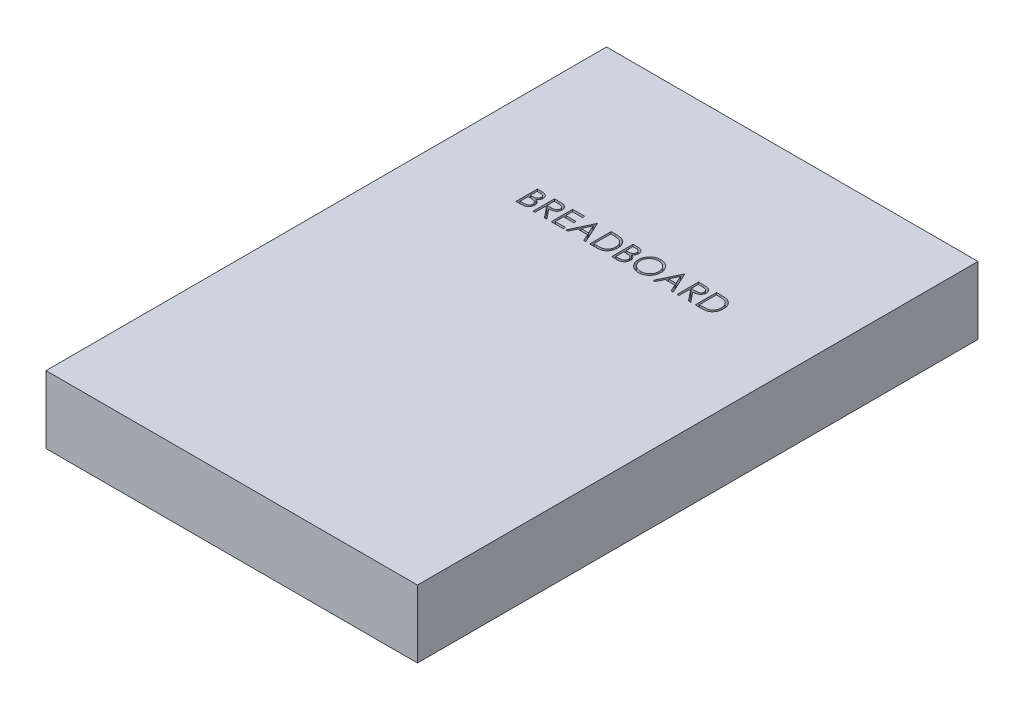
from build123d import *

# Parameters (mm, degrees)
SKETCH1_W           = 55
SKETCH1_H           = 83
BOSS_EXTRUDE1_DEPTH = 10
CUT_EXTRUDE1_DEPTH  = 1


with BuildPart() as part:
    # Sketch1 → Boss-Extrude1 (new body)
    with BuildSketch(Plane(origin=(0, 0, 0), x_dir=(1, 0, 0), z_dir=(0, 1, 0))):
        Rectangle(SKETCH1_W, SKETCH1_H)
    extrude(amount=BOSS_EXTRUDE1_DEPTH)

    # Sketch2 → Cut-Extrude1 (cut)
    # profile 1 of 10: a face of its own
    with BuildSketch(Plane(origin=(0, 10, 0), x_dir=(1, 0, 0), z_dir=(0, 1, 0))):
        with BuildLine():
            Line((-14.40224028, 18.168917942), (-13.78275911, 18.168917942))
            add(Edge.make_bspline(
                [(-13.78275911, 18.168917942), (-13.752434705, 18.168758511), (-13.693658461, 18.168449495), (-13.608187967, 18.16365694), (-13.528133689, 18.157122183), (-13.45347241, 18.146753456), (-13.38423863, 18.134242344), (-13.320223702, 18.11909141), (-13.261631188, 18.100924411), (-13.19167892, 18.072035284), (-13.111922321, 18.02910641), (-13.025563779, 17.965671212), (-12.951718504, 17.888081049), (-12.888049488, 17.800557497), (-12.837429901, 17.70427719), (-12.800809181, 17.601534926), (-12.777624537, 17.493655917), (-12.775240172, 17.419593891), (-12.774035152, 17.382164136)],
                knots=[0, 0, 0, 0, 1.001505555, 1.941167018, 2.826882275, 3.653841531, 4.429895133, 5.150066043, 5.825578002, 6.45369114, 7.647487171, 8.808567382, 9.977351308, 11.170798116, 12.373658725, 13.556498008, 14.765093433, 16, 16, 16, 16], degree=3))
            add(Edge.make_bspline(
                [(-12.774035152, 17.382164136), (-12.775026857, 17.347100746), (-12.776975652, 17.278197879), (-12.795610869, 17.177419651), (-12.82478519, 17.081488188), (-12.865339237, 16.990753596), (-12.918046048, 16.907265961), (-12.98051038, 16.830351798), (-13.055872908, 16.763267625), (-13.112336419, 16.725763706), (-13.141017323, 16.706713415)],
                knots=[0, 0, 0, 0, 1.044552857, 2.05264487, 3.044412934, 4.028983338, 5.005914585, 5.980388656, 6.974128949, 8, 8, 8, 8], degree=3))
            add(Edge.make_bspline(
                [(-13.141017323, 16.706713415), (-13.104948936, 16.69286588), (-13.035941175, 16.666372116), (-12.940976006, 16.619531374), (-12.859156397, 16.568584316), (-12.789853272, 16.512947567), (-12.730582685, 16.452977431), (-12.678827516, 16.387794577), (-12.634666555, 16.316548704), (-12.596826975, 16.23998264), (-12.567300603, 16.158878201), (-12.545188176, 16.07399614), (-12.532517704, 15.985640829), (-12.530714629, 15.92551052), (-12.529804383, 15.895154921)],
                knots=[0, 0, 0, 0, 1.27268992, 2.434971085, 3.483601985, 4.442670788, 5.356604649, 6.2567628, 7.179492994, 8.113709626, 9.066344395, 10.018646069, 10.999752585, 12, 12, 12, 12], degree=3))
            add(Edge.make_bspline(
                [(-12.529804383, 15.895154921), (-12.530690522, 15.864160687), (-12.532434025, 15.803178664), (-12.545297285, 15.713593649), (-12.567076975, 15.62798209), (-12.597077229, 15.545790246), (-12.636231614, 15.467177124), (-12.683881982, 15.392053663), (-12.740697758, 15.321174663), (-12.804254789, 15.253752519), (-12.876156878, 15.193130169), (-12.953731884, 15.139140921), (-13.03795676, 15.09473985), (-13.127448212, 15.057441745), (-13.223210127, 15.028950929), (-13.324812492, 15.009018666), (-13.43216768, 14.995588382), (-13.505836526, 14.994484204), (-13.543616482, 14.993917942)],
                knots=[0, 0, 0, 0, 0.978564426, 1.925352924, 2.850884081, 3.763762016, 4.682927383, 5.618979971, 6.567305752, 7.547517671, 8.540179244, 9.531824382, 10.526200242, 11.540722885, 12.589160233, 13.674978461, 14.80764778, 16, 16, 16, 16], degree=3))
            Line((-13.543616482, 14.993917942), (-14.40224028, 14.993917942))
            Line((-14.40224028, 14.993917942), (-14.40224028, 18.168917942))
        make_face()
        with BuildLine():
            Line((-14.117304383, 17.843276917), (-14.117304383, 16.825648711))
            Line((-14.117304383, 16.825648711), (-13.925863077, 16.825648711))
            add(Edge.make_bspline(
                [(-13.925863077, 16.825648711), (-13.897878812, 16.826011499), (-13.843807511, 16.826712478), (-13.765503033, 16.828720454), (-13.692818195, 16.834342965), (-13.625878461, 16.83996386), (-13.564789244, 16.84910295), (-13.509685884, 16.859981518), (-13.459703585, 16.871486725), (-13.40206414, 16.891053331), (-13.33668368, 16.919970937), (-13.266985078, 16.964848959), (-13.205540238, 17.018301765), (-13.153654218, 17.079979281), (-13.111189527, 17.147893606), (-13.081694942, 17.220961134), (-13.061694906, 17.297360825), (-13.059888302, 17.34981024), (-13.058971049, 17.376439977)],
                knots=[0, 0, 0, 0, 1.156816544, 2.235205308, 3.236616184, 4.169592532, 5.011045266, 5.787822928, 6.49130361, 7.128639758, 8.301311294, 9.436451833, 10.541879658, 11.654887649, 12.756523258, 13.837046038, 14.901820046, 16, 16, 16, 16], degree=3))
            add(Edge.make_bspline(
                [(-13.058971049, 17.376439977), (-13.05944837, 17.394061927), (-13.060384686, 17.428629306), (-13.06805304, 17.479020506), (-13.081086482, 17.526413053), (-13.097827162, 17.571456425), (-13.121221187, 17.612742174), (-13.148765186, 17.651697788), (-13.182044348, 17.686996638), (-13.219924196, 17.719988969), (-13.263474875, 17.749239362), (-13.312670404, 17.774857768), (-13.368176368, 17.795486901), (-13.429057315, 17.813553697), (-13.496250373, 17.826243078), (-13.568980147, 17.836814365), (-13.647842356, 17.84219621), (-13.702402556, 17.842908646), (-13.730605665, 17.843276917)],
                knots=[0, 0, 0, 0, 0.91205012, 1.789085906, 2.630437955, 3.453916878, 4.269457761, 5.079663411, 5.91843418, 6.774407191, 7.675494373, 8.627863946, 9.638891023, 10.736472738, 11.911756761, 13.175263542, 14.539845004, 16, 16, 16, 16], degree=3))
            Line((-13.730605665, 17.843276917), (-14.117304383, 17.843276917))
        make_face(mode=Mode.SUBTRACT)
        with BuildLine():
            Line((-14.117304383, 16.500007686), (-14.117304383, 15.319558968))
            Line((-14.117304383, 15.319558968), (-13.711525136, 15.319558968))
            add(Edge.make_bspline(
                [(-13.711525136, 15.319558968), (-13.682479396, 15.319907082), (-13.626497561, 15.320578025), (-13.545670017, 15.322768371), (-13.470755344, 15.327750649), (-13.402095393, 15.33559367), (-13.338948768, 15.344101263), (-13.282072994, 15.355541497), (-13.231007026, 15.368648768), (-13.171793904, 15.388909053), (-13.105115721, 15.420383709), (-13.033260159, 15.467840185), (-12.969373518, 15.524376329), (-12.915121604, 15.589809373), (-12.870659822, 15.660957791), (-12.83831523, 15.736382501), (-12.818366382, 15.814837229), (-12.815951414, 15.868328461), (-12.81474028, 15.895154921)],
                knots=[0, 0, 0, 0, 1.160039823, 2.235823828, 3.228722157, 4.157150951, 4.99529583, 5.772374946, 6.472645482, 7.099169577, 8.269452708, 9.405989375, 10.527446681, 11.663510218, 12.788923519, 13.866172445, 14.929861265, 16, 16, 16, 16], degree=3))
            add(Edge.make_bspline(
                [(-12.81474028, 15.895154921), (-12.814990746, 15.911931023), (-12.815487638, 15.945212627), (-12.822981196, 15.994121977), (-12.833879492, 16.041498305), (-12.847968722, 16.087470255), (-12.86848781, 16.131206675), (-12.892442318, 16.173572568), (-12.920528733, 16.214623939), (-12.964293083, 16.266523626), (-13.027949098, 16.326319773), (-13.118397387, 16.384864508), (-13.221242257, 16.432079304), (-13.29583434, 16.452126686), (-13.334366682, 16.462482646)],
                knots=[0, 0, 0, 0, 0.723448775, 1.435228256, 2.130040452, 2.821711965, 3.505591119, 4.210454504, 4.921174351, 5.648778258, 7.137944449, 8.670945889, 10.280296675, 12, 12, 12, 12], degree=3))
            add(Edge.make_bspline(
                [(-13.334366682, 16.462482646), (-13.349814505, 16.4656169), (-13.383308571, 16.472412611), (-13.437925448, 16.479586028), (-13.5002787, 16.485976904), (-13.57051231, 16.490704168), (-13.648715137, 16.495590533), (-13.735054199, 16.497490835), (-13.829176906, 16.499758021), (-13.894484273, 16.499922335), (-13.928407147, 16.500007686)],
                knots=[0, 0, 0, 0, 0.634451884, 1.375622551, 2.216452059, 3.157844607, 4.20941857, 5.370758133, 6.634282058, 8, 8, 8, 8], degree=3))
            Line((-13.928407147, 16.500007686), (-14.117304383, 16.500007686))
        make_face(mode=Mode.SUBTRACT)
    # profile 2 of 10: a face of its own
    with BuildSketch(Plane(origin=(0, 10, 0), x_dir=(1, 0, 0), z_dir=(0, 1, 0))):
        with BuildLine():
            Line((-11.878522331, 18.168917942), (-11.243140721, 18.168917942))
            add(Edge.make_bspline(
                [(-11.243140721, 18.168917942), (-11.20073984, 18.168776803), (-11.119325452, 18.168505801), (-11.002691128, 18.166994717), (-10.896712261, 18.162663694), (-10.801444264, 18.158936622), (-10.716888885, 18.152140361), (-10.642786842, 18.145644631), (-10.579479431, 18.137141381), (-10.541156409, 18.129244319), (-10.523804783, 18.125668743)],
                knots=[0, 0, 0, 0, 1.410062039, 2.707475311, 3.878576406, 4.937260626, 5.877586885, 6.699081471, 7.410979367, 8, 8, 8, 8], degree=3))
            add(Edge.make_bspline(
                [(-10.523804783, 18.125668743), (-10.500575917, 18.119929463), (-10.45461372, 18.108573338), (-10.388437588, 18.0845707), (-10.325378166, 18.056794326), (-10.265697397, 18.024170094), (-10.209694215, 17.98645583), (-10.156791176, 17.944302604), (-10.106748219, 17.897941068), (-10.061589169, 17.846202319), (-10.019008744, 17.791922056), (-9.983096204, 17.733226505), (-9.952138612, 17.671847834), (-9.927491071, 17.607161819), (-9.907644624, 17.539795784), (-9.893650821, 17.469139518), (-9.885258672, 17.395514919), (-9.884404275, 17.345297388), (-9.883971049, 17.319834409)],
                knots=[0, 0, 0, 0, 1.027469482, 2.033020251, 3.019912614, 3.986113645, 4.951240523, 5.91722682, 6.890402269, 7.87763091, 8.8651537, 9.85103654, 10.82876324, 11.815024772, 12.821070561, 13.842952187, 14.906261191, 16, 16, 16, 16], degree=3))
            add(Edge.make_bspline(
                [(-9.883971049, 17.319834409), (-9.885303641, 17.277529706), (-9.887903871, 17.194982276), (-9.912147358, 17.07518419), (-9.951858915, 16.963433883), (-10.006580756, 16.859872062), (-10.076266995, 16.766517405), (-10.160018769, 16.684520349), (-10.257882803, 16.615904143), (-10.348986539, 16.568321956), (-10.429462992, 16.537848389), (-10.49571464, 16.516406834), (-10.567983969, 16.499840623), (-10.645578552, 16.484999646), (-10.728821296, 16.473794895), (-10.817512689, 16.465588341), (-10.911715984, 16.460459312), (-10.976430711, 16.459695493), (-11.009722251, 16.459302558)],
                knots=[0, 0, 0, 0, 1.260483769, 2.459530307, 3.627416485, 4.787058657, 5.939039949, 7.08810263, 8.267026773, 9.491475466, 10.141966685, 10.831826277, 11.566392101, 12.351337768, 13.187381173, 14.07005841, 15.007169909, 16, 16, 16, 16], degree=3))
            Line((-11.009722251, 16.459302558), (-9.843265921, 14.993917942))
            Line((-9.843265921, 14.993917942), (-10.195619687, 14.993917942))
            Line((-10.195619687, 14.993917942), (-11.362076017, 16.459302558))
            Line((-11.362076017, 16.459302558), (-11.593586434, 16.459302558))
            Line((-11.593586434, 16.459302558), (-11.593586434, 14.993917942))
            Line((-11.593586434, 14.993917942), (-11.878522331, 14.993917942))
            Line((-11.878522331, 14.993917942), (-11.878522331, 18.168917942))
        make_face()
        with BuildLine():
            Line((-11.593586434, 17.843276917), (-11.593586434, 16.784943583))
            Line((-11.593586434, 16.784943583), (-11.012266322, 16.78049146))
            add(Edge.make_bspline(
                [(-11.012266322, 16.78049146), (-10.985124572, 16.780479452), (-10.932516131, 16.780456178), (-10.856406242, 16.784079104), (-10.785540141, 16.788200543), (-10.720188887, 16.794504592), (-10.660323287, 16.802629028), (-10.605973262, 16.812791735), (-10.557050093, 16.824631821), (-10.499992134, 16.842957581), (-10.436277566, 16.871991612), (-10.367034027, 16.914233172), (-10.308067621, 16.96736373), (-10.258249274, 17.028118222), (-10.218217576, 17.094916819), (-10.189994498, 17.166958811), (-10.172085282, 17.242425475), (-10.169972959, 17.294294187), (-10.168906947, 17.320470426)],
                knots=[0, 0, 0, 0, 1.146690395, 2.22261258, 3.21895312, 4.145990853, 4.996080663, 5.770904154, 6.481378293, 7.121626537, 8.300444488, 9.431385265, 10.535395872, 11.636531494, 12.74115979, 13.810798291, 14.895190096, 16, 16, 16, 16], degree=3))
            add(Edge.make_bspline(
                [(-10.168906947, 17.320470426), (-10.169997442, 17.346003389), (-10.172158407, 17.396600406), (-10.189801218, 17.470673982), (-10.219636586, 17.540584715), (-10.259843187, 17.606048212), (-10.308828135, 17.665471273), (-10.366266436, 17.716314047), (-10.430587578, 17.758268919), (-10.490705022, 17.785078964), (-10.544438915, 17.801516259), (-10.591092963, 17.813083386), (-10.643808375, 17.822376583), (-10.702841113, 17.829822467), (-10.767939164, 17.836222309), (-10.839431683, 17.840532851), (-10.916844333, 17.843085428), (-10.97049905, 17.843211602), (-10.998273934, 17.843276917)],
                knots=[0, 0, 0, 0, 1.101028733, 2.181837193, 3.264309656, 4.369019818, 5.486613113, 6.575447106, 7.666700264, 8.788928104, 9.402425223, 10.0903467, 10.862060571, 11.710948788, 12.657782767, 13.684531032, 14.801375019, 16, 16, 16, 16], degree=3))
            Line((-10.998273934, 17.843276917), (-11.593586434, 17.843276917))
        make_face(mode=Mode.SUBTRACT)
    # profile 3 of 10: a face of its own
    with BuildSketch(Plane(origin=(0, 10, 0), x_dir=(1, 0, 0), z_dir=(0, 1, 0))):
        Polygon((-9.19198387, 18.168917942), (-7.400958229, 18.168917942), (-7.400958229, 17.843276917), (-8.907047972, 17.843276917), (-8.907047972, 16.86635384), (-7.400958229, 16.86635384), (-7.400958229, 16.540712814), (-8.907047972, 16.540712814), (-8.907047972, 15.319558968), (-7.400958229, 15.319558968), (-7.400958229, 14.993917942), (-9.19198387, 14.993917942), align=None)
    # profile 4 of 10: a face of its own
    with BuildSketch(Plane(origin=(0, 10, 0), x_dir=(1, 0, 0), z_dir=(0, 1, 0))):
        Polygon((-5.528522331, 18.168917942), (-4.063137716, 14.993917942), (-4.372878301, 14.993917942), (-4.842259311, 16.011546147), (-6.281567203, 16.011546147), (-6.764304583, 14.993917942), (-7.075317203, 14.993917942), (-5.56922746, 18.168917942), align=None)
        Polygon((-5.552054984, 17.55007279), (-6.12701492, 16.337187173), (-4.992359471, 16.337187173), align=None, mode=Mode.SUBTRACT)
    # profile 5 of 10: a face of its own
    with BuildSketch(Plane(origin=(0, 10, 0), x_dir=(1, 0, 0), z_dir=(0, 1, 0))):
        with BuildLine():
            Line((-3.493265921, 14.993917942), (-3.493265921, 18.168917942))
            Line((-3.493265921, 18.168917942), (-2.852160152, 18.168917942))
            add(Edge.make_bspline(
                [(-2.852160152, 18.168917942), (-2.796398998, 18.168516468), (-2.68866874, 18.167740822), (-2.532991734, 18.162822846), (-2.388952178, 18.154122923), (-2.257023799, 18.141450567), (-2.136844414, 18.125890315), (-2.028750533, 18.106386377), (-1.932183232, 18.08335568), (-1.872793097, 18.063720164), (-1.844708229, 18.054434769)],
                knots=[0, 0, 0, 0, 1.314313732, 2.53924729, 3.670748893, 4.714932338, 5.66265055, 6.526160246, 7.303039223, 8, 8, 8, 8], degree=3))
            add(Edge.make_bspline(
                [(-1.844708229, 18.054434769), (-1.807973715, 18.040436915), (-1.735337705, 18.012758631), (-1.631916958, 17.960546843), (-1.534557522, 17.901389244), (-1.442737298, 17.835207854), (-1.358553691, 17.760128766), (-1.278717956, 17.679341267), (-1.206496028, 17.589907559), (-1.140357788, 17.493682391), (-1.080726154, 17.391799315), (-1.028892775, 17.284452466), (-0.985845224, 17.172186999), (-0.95010994, 17.055315115), (-0.921946368, 16.933579829), (-0.90273133, 16.806839394), (-0.890057646, 16.6755947), (-0.888783971, 16.586536437), (-0.888137716, 16.541348832)],
                knots=[0, 0, 0, 0, 0.984719456, 1.947108742, 2.898477687, 3.838006223, 4.779231079, 5.722358779, 6.681677486, 7.655904652, 8.64651281, 9.637519902, 10.640069247, 11.656948941, 12.698408672, 13.768548281, 14.867775369, 16, 16, 16, 16], degree=3))
            add(Edge.make_bspline(
                [(-0.888137716, 16.541348832), (-0.888708279, 16.502104708), (-0.889832634, 16.424770064), (-0.899928514, 16.310795823), (-0.914602747, 16.200202797), (-0.937321412, 16.093517627), (-0.964900835, 15.9898056), (-1.000246886, 15.890172064), (-1.040737658, 15.793703037), (-1.087954333, 15.701702899), (-1.139789733, 15.614541554), (-1.195417314, 15.53237661), (-1.254777745, 15.456380516), (-1.318437069, 15.386323132), (-1.38557264, 15.322310072), (-1.456623997, 15.263806601), (-1.531774479, 15.211957441), (-1.610687492, 15.164725135), (-1.695665123, 15.123522384), (-1.788316945, 15.088660875), (-1.889038085, 15.059771446), (-1.997581317, 15.035667847), (-2.114134186, 15.016547723), (-2.238810962, 15.003733067), (-2.37142009, 14.995067192), (-2.462478423, 14.994308464), (-2.50934665, 14.993917942)],
                knots=[0, 0, 0, 0, 1.105936401, 2.179363191, 3.223086493, 4.248585256, 5.251745608, 6.245858792, 7.225916811, 8.198733463, 9.158002045, 10.082870192, 10.993790845, 11.873723703, 12.748670949, 13.606408763, 14.465103618, 15.319838547, 16.196477973, 17.123216899, 18.106603292, 19.147568657, 20.255746949, 21.433717677, 22.679120308, 24, 24, 24, 24], degree=3))
            Line((-2.50934665, 14.993917942), (-3.493265921, 14.993917942))
        make_face()
        with BuildLine():
            Line((-3.208330024, 15.319558968), (-2.843891923, 15.319558968))
            add(Edge.make_bspline(
                [(-2.843891923, 15.319558968), (-2.791524044, 15.319784027), (-2.690801434, 15.320216897), (-2.545968822, 15.324015289), (-2.413635369, 15.330221903), (-2.293782286, 15.338907867), (-2.186477242, 15.350400111), (-2.091495984, 15.363213415), (-2.009149856, 15.379176817), (-1.95932101, 15.393646616), (-1.936294767, 15.400333207)],
                knots=[0, 0, 0, 0, 1.375205317, 2.645023457, 3.804390687, 4.853969522, 5.800190428, 6.637939096, 7.370582563, 8, 8, 8, 8], degree=3))
            add(Edge.make_bspline(
                [(-1.936294767, 15.400333207), (-1.907313039, 15.410539977), (-1.85004181, 15.43070973), (-1.767599683, 15.467501323), (-1.690712971, 15.511082343), (-1.618041734, 15.559525835), (-1.55061684, 15.614540422), (-1.487639248, 15.674929819), (-1.429235757, 15.741001365), (-1.376009778, 15.812673055), (-1.328377245, 15.889498798), (-1.287128344, 15.970723311), (-1.250977312, 16.055456632), (-1.22260316, 16.14499994), (-1.200364023, 16.238552729), (-1.18461177, 16.336121579), (-1.17480127, 16.437688271), (-1.173656956, 16.506769126), (-1.173073614, 16.541984849)],
                knots=[0, 0, 0, 0, 0.998632004, 1.973411704, 2.929992603, 3.868527914, 4.809262121, 5.754881198, 6.702106254, 7.672490631, 8.653608572, 9.636854334, 10.631411391, 11.644891563, 12.686317036, 13.754757253, 14.855430412, 16, 16, 16, 16], degree=3))
            add(Edge.make_bspline(
                [(-1.173073614, 16.541984849), (-1.173539238, 16.579117363), (-1.174453963, 16.652064516), (-1.185951373, 16.759098933), (-1.20275307, 16.862042094), (-1.227049699, 16.960900886), (-1.258011282, 17.055868177), (-1.296650707, 17.146418733), (-1.340798283, 17.233508864), (-1.393324882, 17.315128467), (-1.450851884, 17.392320073), (-1.514694675, 17.463036318), (-1.583838953, 17.52743829), (-1.657530566, 17.586528952), (-1.737846363, 17.637931001), (-1.822894354, 17.683911062), (-1.913922213, 17.72293262), (-1.977252301, 17.743687017), (-2.009436795, 17.754234449)],
                knots=[0, 0, 0, 0, 1.122418816, 2.205001699, 3.251619955, 4.274784885, 5.280384055, 6.268708349, 7.249350384, 8.229342522, 9.199999885, 10.157847722, 11.105861043, 12.055065948, 13.010012805, 13.98527497, 14.976112212, 16, 16, 16, 16], degree=3))
            add(Edge.make_bspline(
                [(-2.009436795, 17.754234449), (-2.036062477, 17.761597208), (-2.092675984, 17.777252455), (-2.185058927, 17.794329757), (-2.289031241, 17.80939241), (-2.405054541, 17.82214506), (-2.532996572, 17.831295702), (-2.672955732, 17.838163965), (-2.824992516, 17.842796411), (-2.930386671, 17.843112738), (-2.985087836, 17.843276917)],
                knots=[0, 0, 0, 0, 0.674548936, 1.434276114, 2.292660221, 3.240891867, 4.284742987, 5.42552168, 6.663806718, 8, 8, 8, 8], degree=3))
            Line((-2.985087836, 17.843276917), (-3.208330024, 17.843276917))
            Line((-3.208330024, 17.843276917), (-3.208330024, 15.319558968))
        make_face(mode=Mode.SUBTRACT)
    # profile 6 of 10: a face of its own
    with BuildSketch(Plane(origin=(0, 10, 0), x_dir=(1, 0, 0), z_dir=(0, 1, 0))):
        with BuildLine():
            Line((-0.236855665, 18.168917942), (0.382625505, 18.168917942))
            add(Edge.make_bspline(
                [(0.382625505, 18.168917942), (0.41294991, 18.168758511), (0.471726155, 18.168449495), (0.557196648, 18.16365694), (0.637250927, 18.157122183), (0.711912206, 18.146753456), (0.781145986, 18.134242344), (0.845160914, 18.11909141), (0.903753427, 18.100924411), (0.973705695, 18.072035284), (1.053462295, 18.02910641), (1.139820837, 17.965671212), (1.213666111, 17.888081049), (1.277335127, 17.800557497), (1.327954714, 17.70427719), (1.364575434, 17.601534926), (1.387760078, 17.493655917), (1.390144444, 17.419593891), (1.391349463, 17.382164136)],
                knots=[0, 0, 0, 0, 1.001505555, 1.941167018, 2.826882275, 3.653841531, 4.429895133, 5.150066043, 5.825578002, 6.45369114, 7.647487171, 8.808567382, 9.977351308, 11.170798116, 12.373658725, 13.556498008, 14.765093433, 16, 16, 16, 16], degree=3))
            add(Edge.make_bspline(
                [(1.391349463, 17.382164136), (1.390357758, 17.347100746), (1.388408964, 17.278197879), (1.369773746, 17.177419651), (1.340599426, 17.081488188), (1.300045378, 16.990753596), (1.247338567, 16.907265961), (1.184874235, 16.830351798), (1.109511707, 16.763267625), (1.053048197, 16.725763706), (1.024367292, 16.706713415)],
                knots=[0, 0, 0, 0, 1.044552857, 2.05264487, 3.044412934, 4.028983338, 5.005914585, 5.980388656, 6.974128949, 8, 8, 8, 8], degree=3))
            add(Edge.make_bspline(
                [(1.024367292, 16.706713415), (1.06043568, 16.69286588), (1.129443441, 16.666372116), (1.224408609, 16.619531374), (1.306228218, 16.568584316), (1.375531344, 16.512947567), (1.434801931, 16.452977431), (1.486557099, 16.387794577), (1.53071806, 16.316548704), (1.568557641, 16.23998264), (1.598084012, 16.158878201), (1.62019644, 16.07399614), (1.632866911, 15.985640829), (1.634669986, 15.92551052), (1.635580233, 15.895154921)],
                knots=[0, 0, 0, 0, 1.27268992, 2.434971085, 3.483601985, 4.442670788, 5.356604649, 6.2567628, 7.179492994, 8.113709626, 9.066344395, 10.018646069, 10.999752585, 12, 12, 12, 12], degree=3))
            add(Edge.make_bspline(
                [(1.635580233, 15.895154921), (1.634694094, 15.864160687), (1.632950591, 15.803178664), (1.620087331, 15.713593649), (1.598307641, 15.62798209), (1.568307386, 15.545790246), (1.529153001, 15.467177124), (1.481502633, 15.392053663), (1.424686858, 15.321174663), (1.361129827, 15.253752519), (1.289227738, 15.193130169), (1.211652731, 15.139140921), (1.127427855, 15.09473985), (1.037936404, 15.057441745), (0.942174488, 15.028950929), (0.840572123, 15.009018666), (0.733216935, 14.995588382), (0.659548089, 14.994484204), (0.621768133, 14.993917942)],
                knots=[0, 0, 0, 0, 0.978564426, 1.925352924, 2.850884081, 3.763762016, 4.682927383, 5.618979971, 6.567305752, 7.547517671, 8.540179244, 9.531824382, 10.526200242, 11.540722885, 12.589160233, 13.674978461, 14.80764778, 16, 16, 16, 16], degree=3))
            Line((0.621768133, 14.993917942), (-0.236855665, 14.993917942))
            Line((-0.236855665, 14.993917942), (-0.236855665, 18.168917942))
        make_face()
        with BuildLine():
            Line((0.048080233, 17.843276917), (0.048080233, 16.825648711))
            Line((0.048080233, 16.825648711), (0.239521539, 16.825648711))
            add(Edge.make_bspline(
                [(0.239521539, 16.825648711), (0.267505803, 16.826011499), (0.321577105, 16.826712478), (0.399881582, 16.828720454), (0.47256642, 16.834342965), (0.539506155, 16.83996386), (0.600595372, 16.84910295), (0.655698732, 16.859981518), (0.70568103, 16.871486725), (0.763320475, 16.891053331), (0.828700936, 16.919970937), (0.898399537, 16.964848959), (0.959844377, 17.018301765), (1.011730398, 17.079979281), (1.054195089, 17.147893606), (1.083689673, 17.220961134), (1.10368971, 17.297360825), (1.105496313, 17.34981024), (1.106413566, 17.376439977)],
                knots=[0, 0, 0, 0, 1.156816544, 2.235205308, 3.236616184, 4.169592532, 5.011045266, 5.787822928, 6.49130361, 7.128639758, 8.301311294, 9.436451833, 10.541879658, 11.654887649, 12.756523258, 13.837046038, 14.901820046, 16, 16, 16, 16], degree=3))
            add(Edge.make_bspline(
                [(1.106413566, 17.376439977), (1.105936245, 17.394061927), (1.104999929, 17.428629306), (1.097331576, 17.479020506), (1.084298133, 17.526413053), (1.067557453, 17.571456425), (1.044163428, 17.612742174), (1.016619429, 17.651697788), (0.983340267, 17.686996638), (0.94546042, 17.719988969), (0.90190974, 17.749239362), (0.852714211, 17.774857768), (0.797208247, 17.795486901), (0.7363273, 17.813553697), (0.669134242, 17.826243078), (0.596404469, 17.836814365), (0.517542259, 17.84219621), (0.462982059, 17.842908646), (0.434778951, 17.843276917)],
                knots=[0, 0, 0, 0, 0.91205012, 1.789085906, 2.630437955, 3.453916878, 4.269457761, 5.079663411, 5.91843418, 6.774407191, 7.675494373, 8.627863946, 9.638891023, 10.736472738, 11.911756761, 13.175263542, 14.539845004, 16, 16, 16, 16], degree=3))
            Line((0.434778951, 17.843276917), (0.048080233, 17.843276917))
        make_face(mode=Mode.SUBTRACT)
        with BuildLine():
            Line((0.048080233, 16.500007686), (0.048080233, 15.319558968))
            Line((0.048080233, 15.319558968), (0.453859479, 15.319558968))
            add(Edge.make_bspline(
                [(0.453859479, 15.319558968), (0.482905219, 15.319907082), (0.538887054, 15.320578025), (0.619714598, 15.322768371), (0.694629271, 15.327750649), (0.763289223, 15.33559367), (0.826435848, 15.344101263), (0.883311621, 15.355541497), (0.93437759, 15.368648768), (0.993590712, 15.388909053), (1.060268894, 15.420383709), (1.132124457, 15.467840185), (1.196011097, 15.524376329), (1.250263011, 15.589809373), (1.294724794, 15.660957791), (1.327069385, 15.736382501), (1.347018234, 15.814837229), (1.349433201, 15.868328461), (1.350644335, 15.895154921)],
                knots=[0, 0, 0, 0, 1.160039823, 2.235823828, 3.228722157, 4.157150951, 4.99529583, 5.772374946, 6.472645482, 7.099169577, 8.269452708, 9.405989375, 10.527446681, 11.663510218, 12.788923519, 13.866172445, 14.929861265, 16, 16, 16, 16], degree=3))
            add(Edge.make_bspline(
                [(1.350644335, 15.895154921), (1.350393869, 15.911931023), (1.349896977, 15.945212627), (1.342403419, 15.994121977), (1.331505123, 16.041498305), (1.317415894, 16.087470255), (1.296896806, 16.131206675), (1.272942297, 16.173572568), (1.244855883, 16.214623939), (1.201091532, 16.266523626), (1.137435518, 16.326319773), (1.046987229, 16.384864508), (0.944142358, 16.432079304), (0.869550275, 16.452126686), (0.831017933, 16.462482646)],
                knots=[0, 0, 0, 0, 0.723448775, 1.435228256, 2.130040452, 2.821711965, 3.505591119, 4.210454504, 4.921174351, 5.648778258, 7.137944449, 8.670945889, 10.280296675, 12, 12, 12, 12], degree=3))
            add(Edge.make_bspline(
                [(0.831017933, 16.462482646), (0.81557011, 16.4656169), (0.782076044, 16.472412611), (0.727459168, 16.479586028), (0.665105915, 16.485976904), (0.594872305, 16.490704168), (0.516669478, 16.495590533), (0.430330416, 16.497490835), (0.336207709, 16.499758021), (0.270900343, 16.499922335), (0.236977468, 16.500007686)],
                knots=[0, 0, 0, 0, 0.634451884, 1.375622551, 2.216452059, 3.157844607, 4.20941857, 5.370758133, 6.634282058, 8, 8, 8, 8], degree=3))
            Line((0.236977468, 16.500007686), (0.048080233, 16.500007686))
        make_face(mode=Mode.SUBTRACT)
    # profile 7 of 10: a face of its own
    with BuildSketch(Plane(origin=(0, 10, 0), x_dir=(1, 0, 0), z_dir=(0, 1, 0))):
        with BuildLine():
            add(Edge.make_bspline(
                [(3.772599463, 18.250328199), (3.831389674, 18.248839142), (3.946858497, 18.245914513), (4.116562155, 18.22352704), (4.27857342, 18.184796222), (4.434212046, 18.133213374), (4.581616389, 18.06440261), (4.721895955, 17.981231083), (4.854716977, 17.882827438), (4.97828923, 17.769952354), (5.091370892, 17.64714022), (5.19099866, 17.516078116), (5.274494169, 17.377558488), (5.343061276, 17.231997592), (5.396853587, 17.079724621), (5.433973005, 16.919927776), (5.457684041, 16.753642421), (5.460456068, 16.640225194), (5.461862284, 16.582689977)],
                knots=[0, 0, 0, 0, 1.065120563, 2.091984664, 3.0946048, 4.079830382, 5.057816894, 6.036188127, 7.030412546, 8.04752943, 9.064399622, 10.05169764, 11.02544977, 11.989514704, 12.962713494, 13.945757189, 14.957906945, 16, 16, 16, 16], degree=3))
            add(Edge.make_bspline(
                [(5.461862284, 16.582689977), (5.460456274, 16.52557858), (5.457684865, 16.413005398), (5.433946045, 16.247775274), (5.396715995, 16.088942999), (5.343560811, 15.936773729), (5.275320555, 15.791106939), (5.191269079, 15.652325916), (5.092262409, 15.520385164), (4.979589051, 15.396730103), (4.856760963, 15.283339541), (4.725016364, 15.184534561), (4.587318138, 15.09951339), (4.441894331, 15.031673915), (4.290673584, 14.977452244), (4.132302476, 14.940483787), (3.967523102, 14.916637683), (3.855154406, 14.913899458), (3.798040169, 14.912507686)],
                knots=[0, 0, 0, 0, 1.043624062, 2.057103931, 3.04512605, 4.022047818, 4.998200453, 5.980619268, 6.982898556, 8.009068085, 9.034988726, 10.034168286, 11.015286542, 11.987931943, 12.962482838, 13.94673481, 14.956375938, 16, 16, 16, 16], degree=3))
            add(Edge.make_bspline(
                [(3.798040169, 14.912507686), (3.740505251, 14.913913201), (3.627088612, 14.916683846), (3.460594301, 14.94043412), (3.300685205, 14.977573731), (3.147818615, 15.030650148), (3.001909286, 15.099245779), (2.862671854, 15.182888323), (2.730665199, 15.28213623), (2.606983757, 15.394773051), (2.493818413, 15.517392959), (2.395158122, 15.648778319), (2.31149677, 15.786351483), (2.243131461, 15.930494237), (2.189007273, 16.08050976), (2.152082188, 16.237398736), (2.128191717, 16.400266716), (2.125438678, 16.511158488), (2.124041771, 16.567425554)],
                knots=[0, 0, 0, 0, 1.053102029, 2.075944431, 3.073151272, 4.055350789, 5.033113405, 6.020478099, 7.024410459, 8.052272461, 9.079885166, 10.07527673, 11.055994387, 12.023226415, 12.992069828, 13.970394897, 14.97016774, 16, 16, 16, 16], degree=3))
            add(Edge.make_bspline(
                [(2.124041771, 16.567425554), (2.124526762, 16.605192333), (2.125490625, 16.680249445), (2.137094518, 16.791707004), (2.153932632, 16.9013721), (2.178064367, 17.008932889), (2.209625379, 17.114126068), (2.246865433, 17.217677117), (2.292349435, 17.318536638), (2.34376688, 17.417182429), (2.401154378, 17.512076743), (2.464541665, 17.601774651), (2.53170232, 17.687028841), (2.605329113, 17.765630051), (2.68299546, 17.839864868), (2.765961274, 17.908592476), (2.85372031, 17.97243261), (2.946650183, 18.029963919), (3.042461047, 18.081996849), (3.141227838, 18.126648099), (3.241609157, 18.164971312), (3.344075159, 18.196032632), (3.448353745, 18.22055455), (3.554672506, 18.23725265), (3.662946743, 18.248886138), (3.735891297, 18.249845444), (3.772599463, 18.250328199)],
                knots=[0, 0, 0, 0, 1.037015668, 2.060948919, 3.074880161, 4.083647147, 5.086022904, 6.090072063, 7.104153813, 8.122640571, 9.144368836, 10.147691507, 11.138137339, 12.123020368, 13.103399296, 14.087645067, 15.080126199, 16.082011238, 17.087798457, 18.072939717, 19.057185487, 20.037253025, 21.01195951, 21.997135196, 22.992090687, 24, 24, 24, 24], degree=3))
        make_face()
        with BuildLine():
            add(Edge.make_bspline(
                [(3.786591851, 17.924687173), (3.756461434, 17.92431988), (3.696488647, 17.923588804), (3.607330532, 17.913958834), (3.519344992, 17.900233863), (3.432513857, 17.880656341), (3.347200437, 17.853982664), (3.26260951, 17.823284126), (3.179512454, 17.785890708), (3.098183597, 17.743642612), (3.019339207, 17.696880377), (2.944941971, 17.645198845), (2.874799287, 17.589810014), (2.809082895, 17.530584619), (2.74798576, 17.467221051), (2.690305352, 17.400679913), (2.63835366, 17.329059269), (2.590741744, 17.254301257), (2.548135204, 17.176503251), (2.51024806, 17.096484305), (2.479256424, 17.013591689), (2.453981268, 16.928724703), (2.43302644, 16.842017757), (2.41975138, 16.752813094), (2.410015597, 16.661558957), (2.409326308, 16.599889704), (2.408977669, 16.56869759)],
                knots=[0, 0, 0, 0, 1.008559885, 2.007477868, 2.99961109, 3.989939068, 4.984837346, 5.991145699, 7.001802488, 8.033829008, 9.059044045, 10.069351652, 11.065060232, 12.050310815, 13.029377138, 14.011219647, 14.996725999, 15.989392538, 16.977580475, 17.965360261, 18.951710183, 19.937753436, 20.929683414, 21.935841486, 22.955955122, 24, 24, 24, 24], degree=3))
            add(Edge.make_bspline(
                [(2.408977669, 16.56869759), (2.41013415, 16.522830432), (2.412409308, 16.432595544), (2.432327961, 16.300363013), (2.463009324, 16.173282925), (2.508237077, 16.052050622), (2.564797992, 15.935624022), (2.634672385, 15.825035956), (2.717457413, 15.720256534), (2.811495041, 15.622017254), (2.914294925, 15.532349989), (3.023453901, 15.453643183), (3.137802531, 15.387049599), (3.257639007, 15.332797855), (3.382323561, 15.289808593), (3.512659625, 15.260345834), (3.64777897, 15.240955243), (3.739881779, 15.2390931), (3.786591851, 15.238148711)],
                knots=[0, 0, 0, 0, 1.032063989, 2.030389145, 3.003944642, 3.970395727, 4.937377036, 5.913328081, 6.909231446, 7.93887556, 8.970685674, 9.976071282, 10.964166581, 11.944589148, 12.933237628, 13.927779006, 14.949070134, 16, 16, 16, 16], degree=3))
            add(Edge.make_bspline(
                [(3.786591851, 15.238148711), (3.817987613, 15.238580062), (3.880254839, 15.239435559), (3.972870063, 15.248052216), (4.063816769, 15.261869698), (4.152967395, 15.281763935), (4.240220759, 15.306662472), (4.325941045, 15.33624234), (4.409215208, 15.373146003), (4.491093776, 15.413920216), (4.569467509, 15.460402359), (4.644284599, 15.510329824), (4.713659238, 15.565637072), (4.779326467, 15.623982517), (4.840674442, 15.686542579), (4.897288306, 15.753235923), (4.948977426, 15.824483519), (4.996571263, 15.899128137), (5.039028508, 15.977139023), (5.076020977, 16.057448088), (5.107404596, 16.139857581), (5.13273974, 16.224486363), (5.15259298, 16.311173705), (5.166272622, 16.400035676), (5.175841562, 16.490894508), (5.176562811, 16.552347863), (5.176926386, 16.583325995)],
                knots=[0, 0, 0, 0, 1.047197238, 2.076906641, 3.100256066, 4.114471768, 5.12198147, 6.126382909, 7.136867548, 8.15857795, 9.17633901, 10.174870724, 11.156907918, 12.133735059, 13.104061851, 14.077631395, 15.04955518, 16.038496417, 17.029181396, 18.010275684, 18.986308667, 19.968651475, 20.955262928, 21.950658345, 22.966943676, 24, 24, 24, 24], degree=3))
            add(Edge.make_bspline(
                [(5.176926386, 16.583325995), (5.17656252, 16.614092203), (5.175840723, 16.675122642), (5.166277192, 16.765347813), (5.152578528, 16.853570369), (5.132836642, 16.939443962), (5.107391146, 17.022990481), (5.076015496, 17.10413146), (5.039017403, 17.183169179), (4.996555657, 17.259908292), (4.948825588, 17.333545375), (4.896670096, 17.40394185), (4.839188673, 17.469775694), (4.778023636, 17.532672166), (4.71164719, 17.591289823), (4.640360009, 17.64564811), (4.56502753, 17.697058866), (4.485264966, 17.743437054), (4.402947237, 17.786267108), (4.318479575, 17.822961946), (4.232818892, 17.854142369), (4.146183019, 17.880737044), (4.057842745, 17.900157186), (3.968394986, 17.913971203), (3.877963495, 17.923585453), (3.817145717, 17.924318767), (3.786591851, 17.924687173)],
                knots=[0, 0, 0, 0, 1.02996197, 2.043119294, 3.035359645, 4.018872909, 4.991431989, 5.957985074, 6.929999688, 7.912076566, 8.892894881, 9.867085534, 10.843653904, 11.817741046, 12.803660682, 13.806313499, 14.818574707, 15.856120519, 16.894564902, 17.924820532, 18.937903209, 19.946497019, 20.957711757, 21.963978472, 22.977135795, 24, 24, 24, 24], degree=3))
        make_face(mode=Mode.SUBTRACT)
    # profile 8 of 10: a face of its own
    with BuildSketch(Plane(origin=(0, 10, 0), x_dir=(1, 0, 0), z_dir=(0, 1, 0))):
        Polygon((7.415708438, 18.168917942), (8.881093053, 14.993917942), (8.571352468, 14.993917942), (8.101971459, 16.011546147), (6.662663566, 16.011546147), (6.179926186, 14.993917942), (5.868913566, 14.993917942), (7.37500331, 18.168917942), align=None)
        Polygon((7.392175786, 17.55007279), (6.81721585, 16.337187173), (7.951871298, 16.337187173), align=None, mode=Mode.SUBTRACT)
    # profile 9 of 10: a face of its own
    with BuildSketch(Plane(origin=(0, 10, 0), x_dir=(1, 0, 0), z_dir=(0, 1, 0))):
        with BuildLine():
            Line((9.450964848, 18.168917942), (10.086346459, 18.168917942))
            add(Edge.make_bspline(
                [(10.086346459, 18.168917942), (10.128747339, 18.168776803), (10.210161728, 18.168505801), (10.326796051, 18.166994717), (10.432774918, 18.162663694), (10.528042915, 18.158936622), (10.612598295, 18.152140361), (10.686700337, 18.145644631), (10.750007749, 18.137141381), (10.788330771, 18.129244319), (10.805682396, 18.125668743)],
                knots=[0, 0, 0, 0, 1.410062039, 2.707475311, 3.878576406, 4.937260626, 5.877586885, 6.699081471, 7.410979367, 8, 8, 8, 8], degree=3))
            add(Edge.make_bspline(
                [(10.805682396, 18.125668743), (10.828911262, 18.119929463), (10.87487346, 18.108573338), (10.941049591, 18.0845707), (11.004109014, 18.056794326), (11.063789783, 18.024170094), (11.119792965, 17.98645583), (11.172696004, 17.944302604), (11.22273896, 17.897941068), (11.26789801, 17.846202319), (11.310478436, 17.791922056), (11.346390975, 17.733226505), (11.377348568, 17.671847834), (11.401996108, 17.607161819), (11.421842556, 17.539795784), (11.435836358, 17.469139518), (11.444228507, 17.395514919), (11.445082905, 17.345297388), (11.44551613, 17.319834409)],
                knots=[0, 0, 0, 0, 1.027469482, 2.033020251, 3.019912614, 3.986113645, 4.951240523, 5.91722682, 6.890402269, 7.87763091, 8.8651537, 9.85103654, 10.82876324, 11.815024772, 12.821070561, 13.842952187, 14.906261191, 16, 16, 16, 16], degree=3))
            add(Edge.make_bspline(
                [(11.44551613, 17.319834409), (11.444183539, 17.277529706), (11.441583308, 17.194982276), (11.417339822, 17.07518419), (11.377628264, 16.963433883), (11.322906424, 16.859872062), (11.253220185, 16.766517405), (11.16946841, 16.684520349), (11.071604377, 16.615904143), (10.98050064, 16.568321956), (10.900024188, 16.537848389), (10.83377254, 16.516406834), (10.76150321, 16.499840623), (10.683908628, 16.484999646), (10.600665883, 16.473794895), (10.51197449, 16.465588341), (10.417771196, 16.460459312), (10.353056469, 16.459695493), (10.319764928, 16.459302558)],
                knots=[0, 0, 0, 0, 1.260483769, 2.459530307, 3.627416485, 4.787058657, 5.939039949, 7.08810263, 8.267026773, 9.491475466, 10.141966685, 10.831826277, 11.566392101, 12.351337768, 13.187381173, 14.07005841, 15.007169909, 16, 16, 16, 16], degree=3))
            Line((10.319764928, 16.459302558), (11.486221258, 14.993917942))
            Line((11.486221258, 14.993917942), (11.133867492, 14.993917942))
            Line((11.133867492, 14.993917942), (9.967411162, 16.459302558))
            Line((9.967411162, 16.459302558), (9.735900745, 16.459302558))
            Line((9.735900745, 16.459302558), (9.735900745, 14.993917942))
            Line((9.735900745, 14.993917942), (9.450964848, 14.993917942))
            Line((9.450964848, 14.993917942), (9.450964848, 18.168917942))
        make_face()
        with BuildLine():
            Line((9.735900745, 17.843276917), (9.735900745, 16.784943583))
            Line((9.735900745, 16.784943583), (10.317220858, 16.78049146))
            add(Edge.make_bspline(
                [(10.317220858, 16.78049146), (10.344362607, 16.780479452), (10.396971048, 16.780456178), (10.473080937, 16.784079104), (10.543947038, 16.788200543), (10.609298292, 16.794504592), (10.669163893, 16.802629028), (10.723513918, 16.812791735), (10.772437086, 16.824631821), (10.829495046, 16.842957581), (10.893209614, 16.871991612), (10.962453152, 16.914233172), (11.021419559, 16.96736373), (11.071237905, 17.028118222), (11.111269604, 17.094916819), (11.139492682, 17.166958811), (11.157401897, 17.242425475), (11.15951422, 17.294294187), (11.160580233, 17.320470426)],
                knots=[0, 0, 0, 0, 1.146690395, 2.22261258, 3.21895312, 4.145990853, 4.996080663, 5.770904154, 6.481378293, 7.121626537, 8.300444488, 9.431385265, 10.535395872, 11.636531494, 12.74115979, 13.810798291, 14.895190096, 16, 16, 16, 16], degree=3))
            add(Edge.make_bspline(
                [(11.160580233, 17.320470426), (11.159489737, 17.346003389), (11.157328773, 17.396600406), (11.139685961, 17.470673982), (11.109850594, 17.540584715), (11.069643992, 17.606048212), (11.020659045, 17.665471273), (10.963220743, 17.716314047), (10.898899602, 17.758268919), (10.838782158, 17.785078964), (10.785048265, 17.801516259), (10.738394216, 17.813083386), (10.685678804, 17.822376583), (10.626646067, 17.829822467), (10.561548016, 17.836222309), (10.490055497, 17.840532851), (10.412642846, 17.843085428), (10.35898813, 17.843211602), (10.331213245, 17.843276917)],
                knots=[0, 0, 0, 0, 1.101028733, 2.181837193, 3.264309656, 4.369019818, 5.486613113, 6.575447106, 7.666700264, 8.788928104, 9.402425223, 10.0903467, 10.862060571, 11.710948788, 12.657782767, 13.684531032, 14.801375019, 16, 16, 16, 16], degree=3))
            Line((10.331213245, 17.843276917), (9.735900745, 17.843276917))
        make_face(mode=Mode.SUBTRACT)
    # profile 10 of 10: a face of its own
    with BuildSketch(Plane(origin=(0, 10, 0), x_dir=(1, 0, 0), z_dir=(0, 1, 0))):
        with BuildLine():
            Line((12.13750331, 14.993917942), (12.13750331, 18.168917942))
            Line((12.13750331, 18.168917942), (12.778609079, 18.168917942))
            add(Edge.make_bspline(
                [(12.778609079, 18.168917942), (12.834370232, 18.168516468), (12.942100491, 18.167740822), (13.097777497, 18.162822846), (13.241817053, 18.154122923), (13.373745432, 18.141450567), (13.493924817, 18.125890315), (13.602018697, 18.106386377), (13.698585999, 18.08335568), (13.757976134, 18.063720164), (13.786061002, 18.054434769)],
                knots=[0, 0, 0, 0, 1.314313732, 2.53924729, 3.670748893, 4.714932338, 5.66265055, 6.526160246, 7.303039223, 8, 8, 8, 8], degree=3))
            add(Edge.make_bspline(
                [(13.786061002, 18.054434769), (13.822795515, 18.040436915), (13.895431526, 18.012758631), (13.998852272, 17.960546843), (14.096211709, 17.901389244), (14.188031933, 17.835207854), (14.27221554, 17.760128766), (14.352051275, 17.679341267), (14.424273203, 17.589907559), (14.490411443, 17.493682391), (14.550043077, 17.391799315), (14.601876456, 17.284452466), (14.644924007, 17.172186999), (14.680659291, 17.055315115), (14.708822863, 16.933579829), (14.728037901, 16.806839394), (14.740711585, 16.6755947), (14.74198526, 16.586536437), (14.742631515, 16.541348832)],
                knots=[0, 0, 0, 0, 0.984719456, 1.947108742, 2.898477687, 3.838006223, 4.779231079, 5.722358779, 6.681677486, 7.655904652, 8.64651281, 9.637519902, 10.640069247, 11.656948941, 12.698408672, 13.768548281, 14.867775369, 16, 16, 16, 16], degree=3))
            add(Edge.make_bspline(
                [(14.742631515, 16.541348832), (14.742060951, 16.502104708), (14.740936597, 16.424770064), (14.730840717, 16.310795823), (14.716166484, 16.200202797), (14.693447819, 16.093517627), (14.665868396, 15.9898056), (14.630522344, 15.890172064), (14.590031573, 15.793703037), (14.542814897, 15.701702899), (14.490979498, 15.614541554), (14.435351917, 15.53237661), (14.375991486, 15.456380516), (14.312332162, 15.386323132), (14.24519659, 15.322310072), (14.174145233, 15.263806601), (14.098994752, 15.211957441), (14.020081739, 15.164725135), (13.935104107, 15.123522384), (13.842452286, 15.088660875), (13.741731146, 15.059771446), (13.633187914, 15.035667847), (13.516635044, 15.016547723), (13.391958268, 15.003733067), (13.259349141, 14.995067192), (13.168290808, 14.994308464), (13.12142258, 14.993917942)],
                knots=[0, 0, 0, 0, 1.105936401, 2.179363191, 3.223086493, 4.248585256, 5.251745608, 6.245858792, 7.225916811, 8.198733463, 9.158002045, 10.082870192, 10.993790845, 11.873723703, 12.748670949, 13.606408763, 14.465103618, 15.319838547, 16.196477973, 17.123216899, 18.106603292, 19.147568657, 20.255746949, 21.433717677, 22.679120308, 24, 24, 24, 24], degree=3))
            Line((13.12142258, 14.993917942), (12.13750331, 14.993917942))
        make_face()
        with BuildLine():
            Line((12.422439207, 15.319558968), (12.786877308, 15.319558968))
            add(Edge.make_bspline(
                [(12.786877308, 15.319558968), (12.839245187, 15.319784027), (12.939967797, 15.320216897), (13.084800409, 15.324015289), (13.217133861, 15.330221903), (13.336986945, 15.338907867), (13.444291988, 15.350400111), (13.539273247, 15.363213415), (13.621619374, 15.379176817), (13.671448221, 15.393646616), (13.694474463, 15.400333207)],
                knots=[0, 0, 0, 0, 1.375205317, 2.645023457, 3.804390687, 4.853969522, 5.800190428, 6.637939096, 7.370582563, 8, 8, 8, 8], degree=3))
            add(Edge.make_bspline(
                [(13.694474463, 15.400333207), (13.723456192, 15.410539977), (13.780727421, 15.43070973), (13.863169548, 15.467501323), (13.940056259, 15.511082343), (14.012727497, 15.559525835), (14.080152391, 15.614540422), (14.143129982, 15.674929819), (14.201533474, 15.741001365), (14.254759453, 15.812673055), (14.302391986, 15.889498798), (14.343640887, 15.970723311), (14.379791919, 16.055456632), (14.408166071, 16.14499994), (14.430405208, 16.238552729), (14.446157461, 16.336121579), (14.455967961, 16.437688271), (14.457112274, 16.506769126), (14.457695617, 16.541984849)],
                knots=[0, 0, 0, 0, 0.998632004, 1.973411704, 2.929992603, 3.868527914, 4.809262121, 5.754881198, 6.702106254, 7.672490631, 8.653608572, 9.636854334, 10.631411391, 11.644891563, 12.686317036, 13.754757253, 14.855430412, 16, 16, 16, 16], degree=3))
            add(Edge.make_bspline(
                [(14.457695617, 16.541984849), (14.457229992, 16.579117363), (14.456315268, 16.652064516), (14.444817858, 16.759098933), (14.428016161, 16.862042094), (14.403719531, 16.960900886), (14.372757949, 17.055868177), (14.334118524, 17.146418733), (14.289970947, 17.233508864), (14.237444349, 17.315128467), (14.179917346, 17.392320073), (14.116074556, 17.463036318), (14.046930278, 17.52743829), (13.973238665, 17.586528952), (13.892922868, 17.637931001), (13.807874877, 17.683911062), (13.716847018, 17.72293262), (13.653516929, 17.743687017), (13.621332436, 17.754234449)],
                knots=[0, 0, 0, 0, 1.122418816, 2.205001699, 3.251619955, 4.274784885, 5.280384055, 6.268708349, 7.249350384, 8.229342522, 9.199999885, 10.157847722, 11.105861043, 12.055065948, 13.010012805, 13.98527497, 14.976112212, 16, 16, 16, 16], degree=3))
            add(Edge.make_bspline(
                [(13.621332436, 17.754234449), (13.594706753, 17.761597208), (13.538093246, 17.777252455), (13.445710304, 17.794329757), (13.34173799, 17.80939241), (13.22571469, 17.82214506), (13.097772659, 17.831295702), (12.957813499, 17.838163965), (12.805776715, 17.842796411), (12.700382559, 17.843112738), (12.645681394, 17.843276917)],
                knots=[0, 0, 0, 0, 0.674548936, 1.434276114, 2.292660221, 3.240891867, 4.284742987, 5.42552168, 6.663806718, 8, 8, 8, 8], degree=3))
            Line((12.645681394, 17.843276917), (12.422439207, 17.843276917))
            Line((12.422439207, 17.843276917), (12.422439207, 15.319558968))
        make_face(mode=Mode.SUBTRACT)
    extrude(amount=-CUT_EXTRUDE1_DEPTH, mode=Mode.SUBTRACT)


solid = part.part
